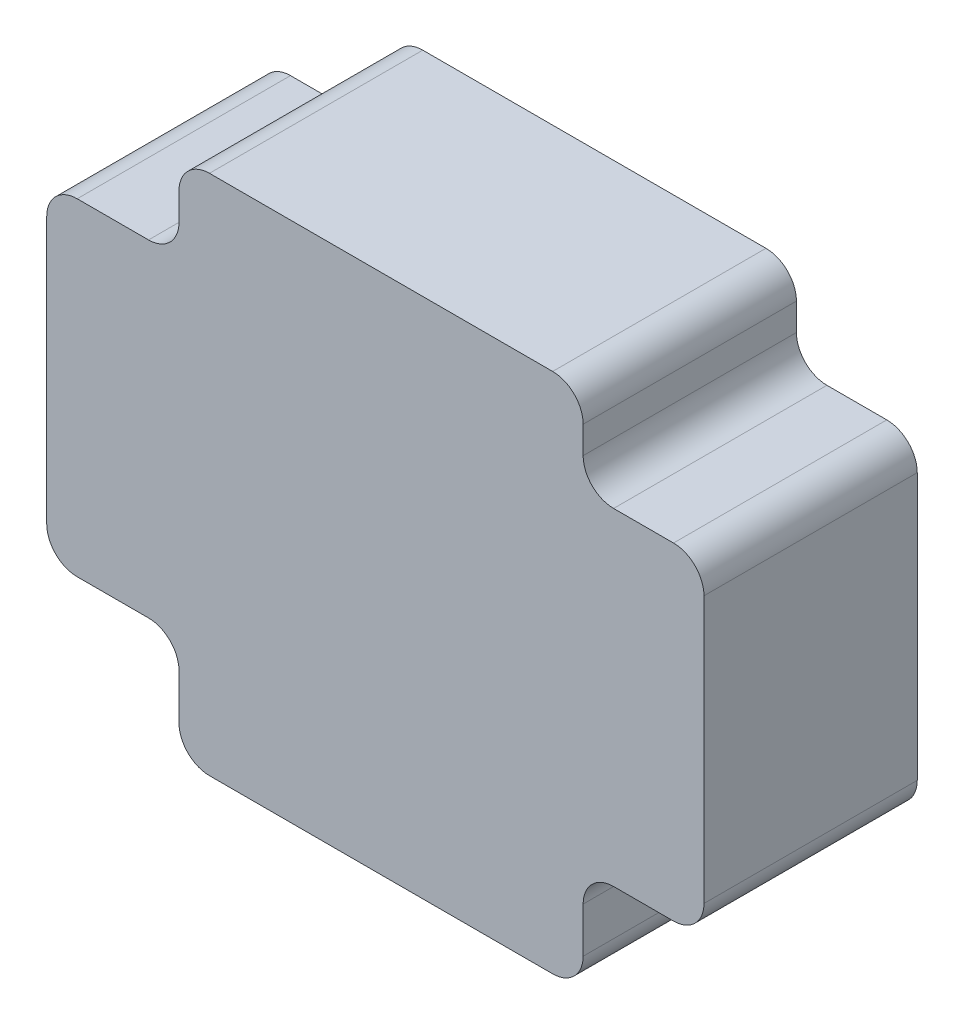
from build123d import *

# Parameters (mm, degrees)
BOSS_EXTRUDE1_DEPTH = 70
SHELL1_T            = -8
RIB15_REACH         = 159.422
SKETCH3_WALLS_W     = 5
SKETCH3_WALLS_H     = 472.061491267
SKETCH3_WALLS_W_2   = 516.540635297
SKETCH3_WALLS_H_2   = 5


with BuildPart() as part:
    # Sketch1 → Boss-Extrude1 (new body)
    with BuildSketch(Plane.XY):
        with BuildLine():
            Line((76.31679607, 53.723303483), (95.972900387, 53.723303483))
            ThreePointArc((95.972900387, 53.723303483), (103.043968199, 50.794371295), (105.972900387, 43.723303483))
            Line((105.972900387, 43.723303483), (105.972900387, -43.723303483))
            ThreePointArc((105.972900387, -43.723303483), (103.043968199, -50.794371295), (95.972900387, -53.723303483))
            Line((95.972900387, -53.723303483), (76.31679607, -53.723303483))
            ThreePointArc((76.31679607, -53.723303483), (69.245728258, -56.652235671), (66.31679607, -63.723303483))
            Line((66.31679607, -63.723303483), (66.31679607, -78.556368085))
            ThreePointArc((66.31679607, -78.556368085), (63.387863882, -85.627435897), (56.31679607, -88.556368085))
            Line((56.31679607, -88.556368085), (-56.31679607, -88.556368085))
            ThreePointArc((-56.31679607, -88.556368085), (-63.387863882, -85.627435897), (-66.31679607, -78.556368085))
            Line((-66.31679607, -78.556368085), (-66.31679607, -63.723303483))
            ThreePointArc((-66.31679607, -63.723303483), (-69.245728258, -56.652235671), (-76.31679607, -53.723303483))
            Line((-76.31679607, -53.723303483), (-99.724153498, -53.723303483))
            ThreePointArc((-99.724153498, -53.723303483), (-106.79522131, -50.794371295), (-109.724153498, -43.723303483))
            Line((-109.724153498, -43.723303483), (-109.724153498, 43.723303483))
            ThreePointArc((-109.724153498, 43.723303483), (-106.79522131, 50.794371295), (-99.724153498, 53.723303483))
            Line((-99.724153498, 53.723303483), (-76.31679607, 53.723303483))
            ThreePointArc((-76.31679607, 53.723303483), (-69.245728258, 56.652235671), (-66.31679607, 63.723303483))
            Line((-66.31679607, 63.723303483), (-66.31679607, 72.661541768))
            ThreePointArc((-66.31679607, 72.661541768), (-63.387863882, 79.73260958), (-56.31679607, 82.661541768))
            Line((-56.31679607, 82.661541768), (56.31679607, 82.661541768))
            ThreePointArc((56.31679607, 82.661541768), (63.387863882, 79.73260958), (66.31679607, 72.661541768))
            Line((66.31679607, 72.661541768), (66.31679607, 63.723303483))
            ThreePointArc((66.31679607, 63.723303483), (69.245728258, 56.652235671), (76.31679607, 53.723303483))
        make_face()
    extrude(amount=BOSS_EXTRUDE1_DEPTH)

    # Shell1
    shell1_openings = [part.faces().sort_by_distance(p)[0] for p in [
        (-1.372763961, -2.113601646, 0),
    ]]
    offset(amount=SHELL1_T, openings=shell1_openings, kind=Kind.INTERSECTION)

    # Sketch3 walls → Rib15 (add, up to next)
    with BuildSketch(Plane.XY, mode=Mode.PRIVATE) as rib15_sk1:
        with Locations((-34.103750382, -2.947413158)):
            Rectangle(SKETCH3_WALLS_W, SKETCH3_WALLS_H)
    rib15_tool1 = extrude(rib15_sk1.sketch, amount=RIB15_REACH, mode=Mode.PRIVATE) - part.part
    # Sketch3 walls → Rib15 (add, up to next)
    with BuildSketch(Plane.XY, mode=Mode.PRIVATE) as rib15_sk2:
        with Locations((2.728391134, -2.947413158)):
            Rectangle(SKETCH3_WALLS_W, SKETCH3_WALLS_H)
    rib15_tool2 = extrude(rib15_sk2.sketch, amount=RIB15_REACH, mode=Mode.PRIVATE) - part.part
    # Sketch3 walls → Rib15 (add, up to next)
    with BuildSketch(Plane.XY, mode=Mode.PRIVATE) as rib15_sk3:
        with Locations((36.963394466, -2.947413158)):
            Rectangle(SKETCH3_WALLS_W, SKETCH3_WALLS_H)
    rib15_tool3 = extrude(rib15_sk3.sketch, amount=RIB15_REACH, mode=Mode.PRIVATE) - part.part
    # Sketch3 walls → Rib15 (add, up to next)
    with BuildSketch(Plane.XY, mode=Mode.PRIVATE) as rib15_sk4:
        with Locations((-1.875626555, 2.364914945)):
            Rectangle(SKETCH3_WALLS_W_2, SKETCH3_WALLS_H_2)
    rib15_tool4 = extrude(rib15_sk4.sketch, amount=RIB15_REACH, mode=Mode.PRIVATE) - part.part
    add(rib15_tool1.solids().sort_by_distance((-34.103750382, -2.947413159, 0))[0])
    add(rib15_tool2.solids().sort_by_distance((2.728391134, -2.947413159, 0))[0])
    add(rib15_tool3.solids().sort_by_distance((36.963394466, -2.947413159, 0))[0])
    add(rib15_tool4.solids().sort_by_distance((-1.875626556, 2.364914945, 0))[0])


solid = part.part
